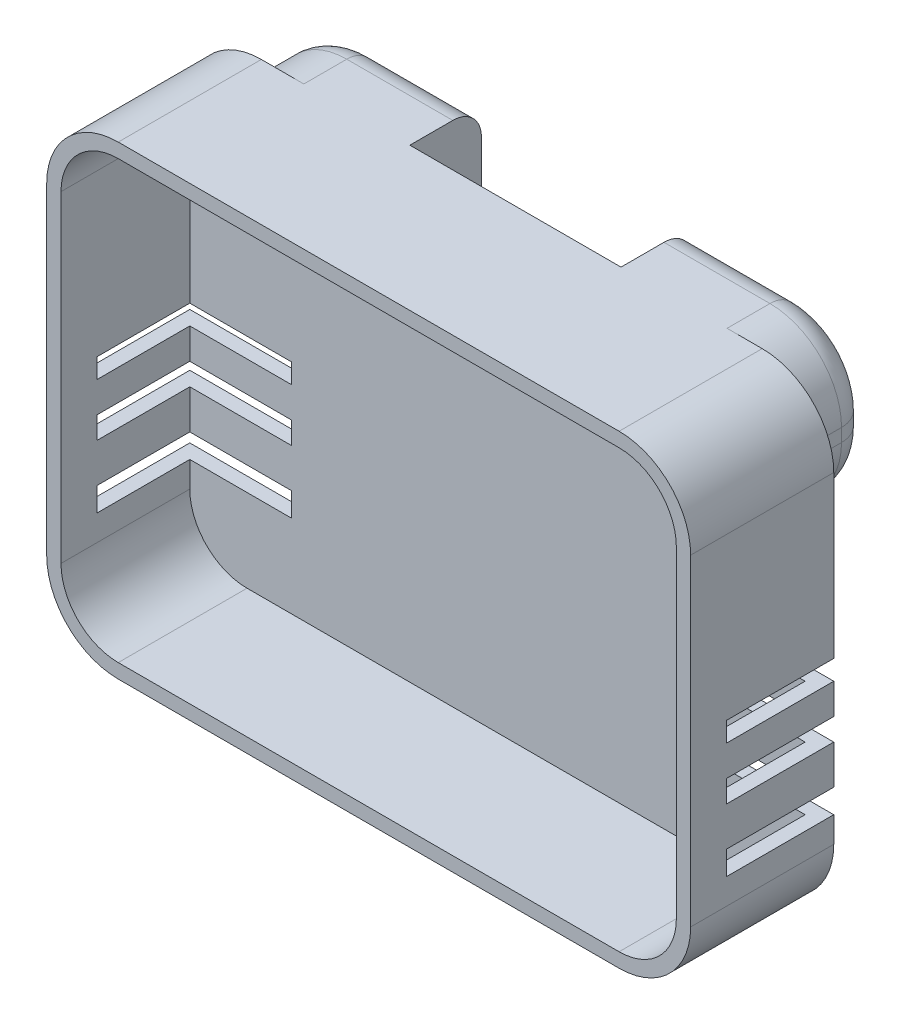
from build123d import *

# Parameters (mm, degrees)
RESSALTO_EXTRUS_O1_DEPTH   = 20
CASCA1_T                   = -2
RESSALTO_EXTRUS_O2_DEPTH   = 10
FILETE1_R                  = 4
ESBO_O5_W                  = 23.985697769
ESBO_O5_H                  = 6
CORTE_EXTRUS_O1_DEPTH      = 15
ESBO_O6_W                  = 24.497787774
ESBO_O6_H                  = 6.032330751
CORTE_EXTRUS_O2_DEPTH      = 15
CORTE_EXTRUS_O3_DEPTH      = 15
CORTE_EXTRUS_O3_DEPTH_BACK = 15
ESBO_O7_W                  = 38.492647719
ESBO_O7_H                  = 2.75587166
ESBO_O7_H_2                = 3.088916175
ESBO_O7_H_3                = 3.326525112
ESBO_O7_W_2                = 34.690904734


with BuildPart() as part:
    # Esboço1 → Ressalto-extrusão1 (new body)
    with BuildSketch(Plane.XY):
        with BuildLine():
            Line((-35, 32.5), (35, 32.5))
            ThreePointArc((35, 32.5), (42.071067812, 29.571067812), (45, 22.5))
            Line((45, 22.5), (45, -22.5))
            ThreePointArc((45, -22.5), (42.071067812, -29.571067812), (35, -32.5))
            Line((35, -32.5), (-35, -32.5))
            ThreePointArc((-35, -32.5), (-42.071067812, -29.571067812), (-45, -22.5))
            Line((-45, -22.5), (-45, 22.5))
            ThreePointArc((-45, 22.5), (-42.071067812, 29.571067812), (-35, 32.5))
        make_face()
    extrude(amount=RESSALTO_EXTRUS_O1_DEPTH)

    # Casca1
    casca1_openings = [part.faces().sort_by_distance(p)[0] for p in [
        (0, 0, 20),
    ]]
    offset(amount=CASCA1_T, openings=casca1_openings, kind=Kind.INTERSECTION)

    # Esboço2 → Ressalto-extrusão2 (add)
    with BuildSketch(Plane(origin=(0, 0, 0), x_dir=(-1, 0, 0), z_dir=(0, 0, -1))):
        with BuildLine():
            Line((-30.08601431, 32.5), (-15.268763233, 32.5))
            Line((-15.268763233, 32.5), (-15.268763233, 10.675395158))
            Line((-15.268763233, 10.675395158), (-30.08601431, 10.675395158))
            ThreePointArc((-30.08601431, 10.675395158), (-37.157082122, 13.604327346), (-40.08601431, 20.675395158))
            Line((-40.08601431, 20.675395158), (-40.08601431, 22.5))
            ThreePointArc((-40.08601431, 22.5), (-37.157082122, 29.571067812), (-30.08601431, 32.5))
        make_face()
        with BuildLine():
            Line((14.243643453, 32.5), (29.06089453, 32.5))
            ThreePointArc((29.06089453, 32.5), (36.131962342, 29.571067812), (39.06089453, 22.5))
            Line((39.06089453, 22.5), (39.06089453, 20.675395158))
            ThreePointArc((39.06089453, 20.675395158), (36.131962342, 13.604327346), (29.06089453, 10.675395158))
            Line((29.06089453, 10.675395158), (14.243643453, 10.675395158))
            Line((14.243643453, 10.675395158), (14.243643453, 32.5))
        make_face()
    extrude(amount=RESSALTO_EXTRUS_O2_DEPTH)

    # Filete1
    filete1_edges = [part.edges().sort_by_distance(p)[0] for p in [
        (-21.652268991, 10.675395158, -10),
        (-36.131962342, 13.604327346, -10),
        (-39.06089453, 21.587697579, -10),
        (-36.131962342, 29.571067812, -10),
        (22.677388772, 10.675395158, -10),
        (37.157082122, 13.604327346, -10),
        (40.08601431, 21.587697579, -10),
        (37.157082122, 29.571067812, -10),
        (-21.652268991, 32.5, -10),
        (22.677388772, 32.5, -10),
    ]]
    fillet(filete1_edges, radius=FILETE1_R)

    # Esboço5 → Corte-extrusão1 (cut)
    with BuildSketch(Plane(origin=(0, 10.675395158, 0), x_dir=(-1, 0, 0), z_dir=(0, -1, 0))):
        with Locations((-24.546243996, 3)):
            Rectangle(ESBO_O5_W, ESBO_O5_H)
    extrude(amount=-CORTE_EXTRUS_O1_DEPTH, mode=Mode.SUBTRACT)

    # Esboço6 → Corte-extrusão2 (cut)
    with BuildSketch(Plane.XZ.offset(-10.675395158)):
        with Locations((-22.916938832, -3.016165375)):
            Rectangle(ESBO_O6_W, ESBO_O6_H)
    extrude(amount=-CORTE_EXTRUS_O2_DEPTH, mode=Mode.SUBTRACT)

    # Esboço7 → Corte-extrusão3 (cut, two sides: drawn at the far end of the back side and taken through both)
    with BuildSketch(Plane(origin=(0, 0, 0), x_dir=(-1, 0, 0), z_dir=(0, 0, -1)).offset(-CORTE_EXTRUS_O3_DEPTH_BACK)):
        with Locations((-45.552020228, -1.37793583)):
            Rectangle(ESBO_O7_W, ESBO_O7_H)
        with Locations((-45.552020228, -8.577290605)):
            Rectangle(ESBO_O7_W, ESBO_O7_H_2)
        with Locations((-45.552020228, -17.250016789)):
            Rectangle(ESBO_O7_W, ESBO_O7_H_3)
        with Locations((46.165029276, -1.37793583)):
            Rectangle(ESBO_O7_W_2, ESBO_O7_H)
        with Locations((46.165029276, -8.577290605)):
            Rectangle(ESBO_O7_W_2, ESBO_O7_H_2)
        with Locations((46.165029276, -17.250016789)):
            Rectangle(ESBO_O7_W_2, ESBO_O7_H_3)
    extrude(amount=CORTE_EXTRUS_O3_DEPTH + CORTE_EXTRUS_O3_DEPTH_BACK, mode=Mode.SUBTRACT)


solid = part.part
